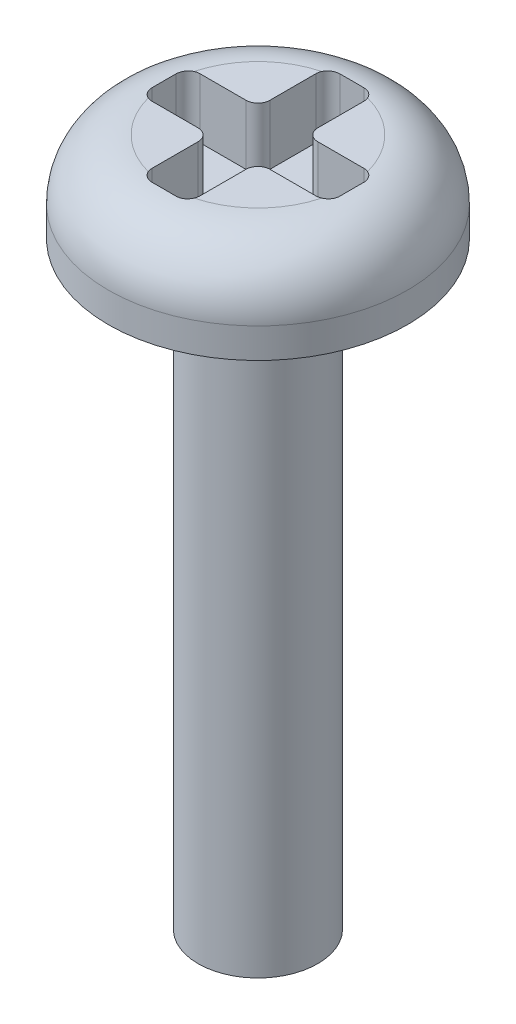
from build123d import *

# Parameters (mm, degrees)
SKETCH1_R           = 1
BOSS_EXTRUDE1_DEPTH = 10
SKETCH2_R           = 2.5
BOSS_EXTRUDE2_DEPTH = 1.5
FILLET1_R           = 1
CUT_EXTRUDE1_DEPTH  = 1


with BuildPart() as part:
    # Sketch1 → Boss-Extrude1 (new body)
    with BuildSketch(Plane(origin=(0, 0, 0), x_dir=(1, 0, 0), z_dir=(0, 1, 0))):
        with Locations(Location((0, 0, 0), (0, 0, 270))):
            Circle(SKETCH1_R)
    extrude(amount=BOSS_EXTRUDE1_DEPTH)

    # Sketch2 → Boss-Extrude2 (add)
    with BuildSketch(Plane(origin=(0, 10, 0), x_dir=(1, 0, 0), z_dir=(0, 1, 0))):
        with Locations(Location((0, 0, 0), (0, 0, 270))):
            Circle(SKETCH2_R)
    extrude(amount=BOSS_EXTRUDE2_DEPTH)

    # Fillet1
    fillet1_edges = [part.edges().sort_by_distance(p)[0] for p in [
        (0, 11.5, -2.5),
    ]]
    fillet(fillet1_edges, radius=FILLET1_R)

    # Sketch3 → Cut-Extrude1 (cut)
    with BuildSketch(Plane(origin=(0, 11.5, 0), x_dir=(1, 0, 0), z_dir=(0, 1, 0))):
        with BuildLine():
            Line((-0.4, 0.6), (-0.4, 1.369908904))
            ThreePointArc((-0.4, 1.369908904), (-0.341421356, 1.51133026), (-0.2, 1.569908904))
            Line((-0.2, 1.569908904), (0.2, 1.569908904))
            ThreePointArc((0.2, 1.569908904), (0.341421356, 1.51133026), (0.4, 1.369908904))
            Line((0.4, 1.369908904), (0.4, 0.6))
            ThreePointArc((0.4, 0.6), (0.458578644, 0.458578644), (0.6, 0.4))
            Line((0.6, 0.4), (1.37, 0.4))
            ThreePointArc((1.37, 0.4), (1.511421356, 0.341421356), (1.57, 0.2))
            Line((1.57, 0.2), (1.57, -0.2))
            ThreePointArc((1.57, -0.2), (1.511421356, -0.341421356), (1.37, -0.4))
            Line((1.37, -0.4), (0.6, -0.4))
            ThreePointArc((0.6, -0.4), (0.458578644, -0.458578644), (0.4, -0.6))
            Line((0.4, -0.6), (0.4, -1.369908904))
            ThreePointArc((0.4, -1.369908904), (0.341421356, -1.51133026), (0.2, -1.569908904))
            Line((0.2, -1.569908904), (-0.2, -1.569908904))
            ThreePointArc((-0.2, -1.569908904), (-0.341421356, -1.51133026), (-0.4, -1.369908904))
            Line((-0.4, -1.369908904), (-0.4, -0.6))
            ThreePointArc((-0.4, -0.6), (-0.458578644, -0.458578644), (-0.6, -0.4))
            Line((-0.6, -0.4), (-1.37, -0.4))
            ThreePointArc((-1.37, -0.4), (-1.511421356, -0.341421356), (-1.57, -0.2))
            Line((-1.57, -0.2), (-1.57, 0.2))
            ThreePointArc((-1.57, 0.2), (-1.511421356, 0.341421356), (-1.37, 0.4))
            Line((-1.37, 0.4), (-0.6, 0.4))
            ThreePointArc((-0.6, 0.4), (-0.458578644, 0.458578644), (-0.4, 0.6))
        make_face()
    extrude(amount=-CUT_EXTRUDE1_DEPTH, mode=Mode.SUBTRACT)


solid = part.part
